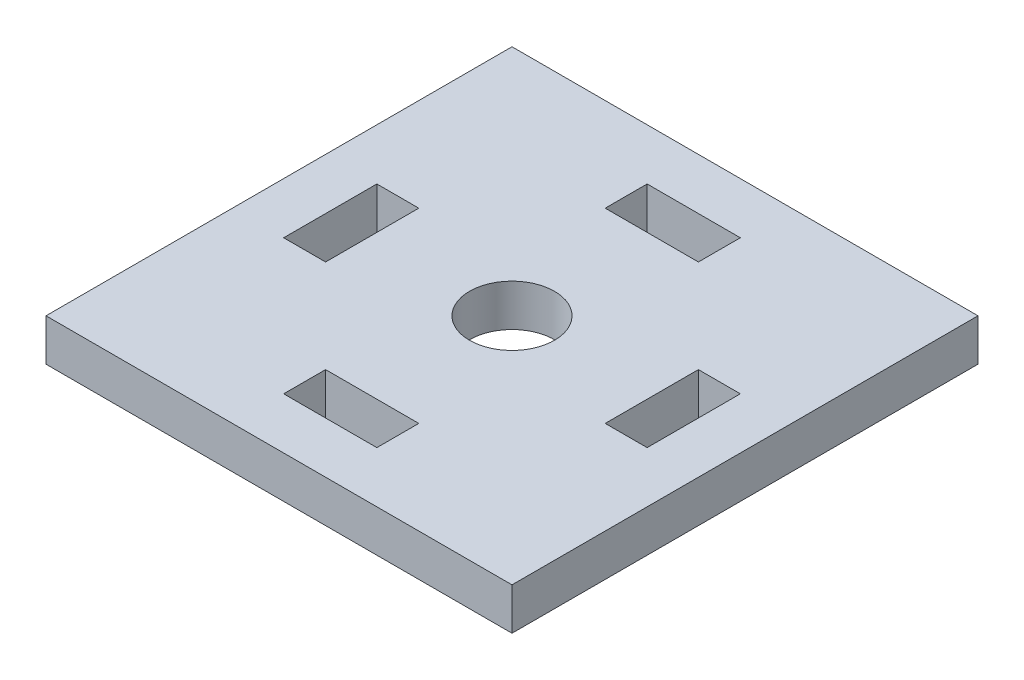
from build123d import *

# Parameters (mm, degrees)
SKETCH1_W           = 50
SKETCH1_H           = 50
SKETCH1_R           = 4.557723878
SKETCH1_W_2         = 4.5
SKETCH1_H_2         = 10
SKETCH1_W_3         = 10
SKETCH1_H_3         = 4.5
BOSS_EXTRUDE1_DEPTH = 4.5


with BuildPart() as part:
    # Sketch1 → Boss-Extrude1 (new body)
    with BuildSketch(Plane(origin=(0, 0, 0), x_dir=(1, 0, 0), z_dir=(0, 1, 0))):
        with Locations((-22.88315405, -24.596252602)):
            Rectangle(SKETCH1_W, SKETCH1_H)
        with Locations(Location((-22.88315405, -24.596252602, 0), (0, 0, 270))):
            Circle(SKETCH1_R, mode=Mode.SUBTRACT)
        with Locations((-40.13315405, -24.596252602)):
            Rectangle(SKETCH1_W_2, SKETCH1_H_2, mode=Mode.SUBTRACT)
        with Locations((-22.88315405, -7.346252602)):
            Rectangle(SKETCH1_W_3, SKETCH1_H_3, mode=Mode.SUBTRACT)
        with Locations((-5.63315405, -24.596252602)):
            Rectangle(SKETCH1_W_2, SKETCH1_H_2, mode=Mode.SUBTRACT)
        with Locations((-22.88315405, -41.846252602)):
            Rectangle(SKETCH1_W_3, SKETCH1_H_3, mode=Mode.SUBTRACT)
    extrude(amount=BOSS_EXTRUDE1_DEPTH)


solid = part.part
